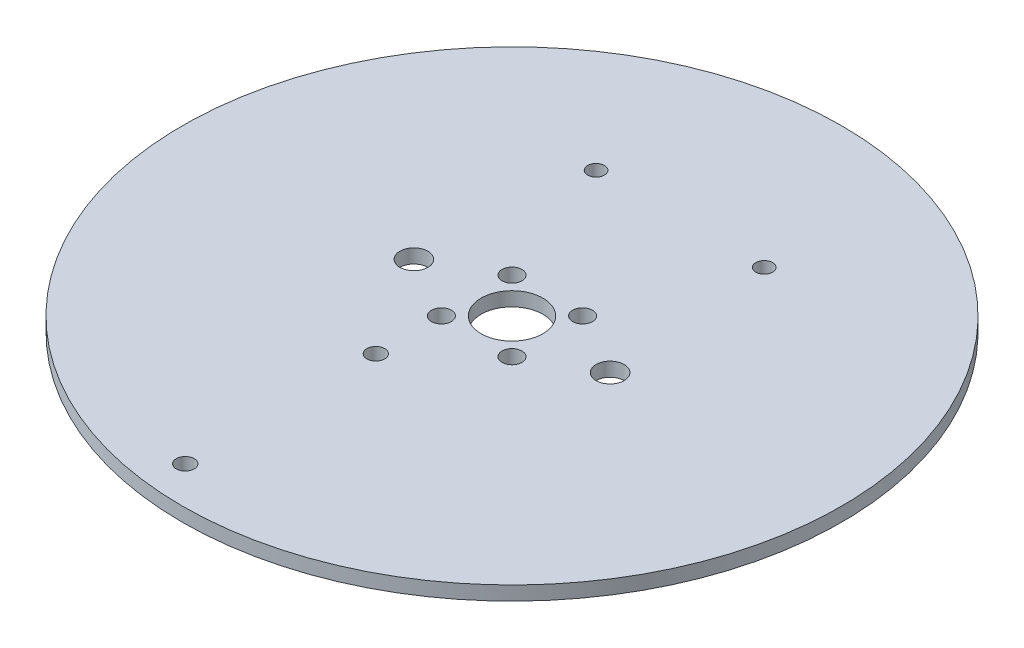
from build123d import *

# Parameters (mm, degrees)
SKETCH1_R               = 74.676
BOSS_EXTRUDE1_DEPTH     = 3.175
CUT_EXTRUDE1_REACH      = 107.656
SKETCH2_R               = 7
CUT_EXTRUDE3_DEPTH      = 106.655527906
CUT_EXTRUDE3_DEPTH_BACK = 106.655527906
SKETCH4_R               = 3.175
M4_CLEARANCE_HOLE1_D    = 4.5
CUT_EXTRUDE4_REACH      = 107.656
SKETCH8_R               = 1.89865
CUT_EXTRUDE5_REACH      = 107.656
SKETCH9_R               = 2.032


with BuildPart() as part:
    # Sketch1 → Boss-Extrude1 (new body)
    with BuildSketch(Plane(origin=(0, 0, 0), x_dir=(1, 0, 0), z_dir=(0, 1, 0))):
        with Locations(Location((0, 0, 0), (0, 0, 270))):
            Circle(SKETCH1_R)
    extrude(amount=BOSS_EXTRUDE1_DEPTH)

    # Sketch2 → Cut-Extrude1 (cut, up to next)
    with BuildSketch(Plane(origin=(0, 3.175, 0), x_dir=(1, 0, 0), z_dir=(0, 1, 0)), mode=Mode.PRIVATE) as cut_extrude1_sk1:
        with Locations(Location((0, 0, 0), (0, 0, 270))):
            Circle(SKETCH2_R)
    cut_extrude1_tool1 = extrude(cut_extrude1_sk1.sketch, amount=-CUT_EXTRUDE1_REACH, mode=Mode.PRIVATE) & part.part
    add(cut_extrude1_tool1.solids().sort_by_distance((0, 3.175, 0))[0], mode=Mode.SUBTRACT)

    # Sketch4 → Cut-Extrude3 (cut, two sides: drawn at the far end of the back side and taken through both)
    with BuildSketch(Plane(origin=(0, 3.175, 0), x_dir=(1, 0, 0), z_dir=(0, 1, 0)).offset(-CUT_EXTRUDE3_DEPTH_BACK)):
        with Locations(Location((-22.225, 0, 0), (0, 0, 270))):
            Circle(SKETCH4_R)
        with Locations(Location((22.225, 0, 0), (0, 0, 270))):
            Circle(SKETCH4_R)
    extrude(amount=CUT_EXTRUDE3_DEPTH + CUT_EXTRUDE3_DEPTH_BACK, mode=Mode.SUBTRACT)

    # M4 Clearance Hole1 (through all)
    with Locations(Plane(origin=(0, 3.175, 0), x_dir=(1, 0, 0), z_dir=(0, 1, 0))):
        with Locations((-8, 8), (8, 8), (8, -8), (-8, -8)):
            Hole(M4_CLEARANCE_HOLE1_D / 2)

    # Sketch8 → Cut-Extrude4 (cut, up to next)
    with BuildSketch(Plane(origin=(0, 3.175, 0), x_dir=(1, 0, 0), z_dir=(0, 1, 0)), mode=Mode.PRIVATE) as cut_extrude4_sk1:
        with Locations(Location((19.05, 38.1, 0), (0, 0, 270))):
            Circle(SKETCH8_R)
    cut_extrude4_tool1 = extrude(cut_extrude4_sk1.sketch, amount=-CUT_EXTRUDE4_REACH, mode=Mode.PRIVATE) & part.part
    # Sketch8 → Cut-Extrude4 (cut, up to next)
    with BuildSketch(Plane(origin=(0, 3.175, 0), x_dir=(1, 0, 0), z_dir=(0, 1, 0)), mode=Mode.PRIVATE) as cut_extrude4_sk2:
        with Locations(Location((-19.05, 38.1, 0), (0, 0, 270))):
            Circle(SKETCH8_R)
    cut_extrude4_tool2 = extrude(cut_extrude4_sk2.sketch, amount=-CUT_EXTRUDE4_REACH, mode=Mode.PRIVATE) & part.part
    add(cut_extrude4_tool1.solids().sort_by_distance((19.05, 3.175, -38.1))[0], mode=Mode.SUBTRACT)
    add(cut_extrude4_tool2.solids().sort_by_distance((-19.05, 3.175, -38.1))[0], mode=Mode.SUBTRACT)

    # Sketch9 → Cut-Extrude5 (cut, up to next)
    with BuildSketch(Plane(origin=(0, 3.175, 0), x_dir=(1, 0, 0), z_dir=(0, 1, 0)), mode=Mode.PRIVATE) as cut_extrude5_sk1:
        with Locations(Location((-8, -22.86, 0), (0, 0, 270))):
            Circle(SKETCH9_R)
    cut_extrude5_tool1 = extrude(cut_extrude5_sk1.sketch, amount=-CUT_EXTRUDE5_REACH, mode=Mode.PRIVATE) & part.part
    # Sketch9 → Cut-Extrude5 (cut, up to next)
    with BuildSketch(Plane(origin=(0, 3.175, 0), x_dir=(1, 0, 0), z_dir=(0, 1, 0)), mode=Mode.PRIVATE) as cut_extrude5_sk2:
        with Locations(Location((-8, -66.04, 0), (0, 0, 270))):
            Circle(SKETCH9_R)
    cut_extrude5_tool2 = extrude(cut_extrude5_sk2.sketch, amount=-CUT_EXTRUDE5_REACH, mode=Mode.PRIVATE) & part.part
    add(cut_extrude5_tool1.solids().sort_by_distance((-8, 3.175, 22.86))[0], mode=Mode.SUBTRACT)
    add(cut_extrude5_tool2.solids().sort_by_distance((-8, 3.175, 66.04))[0], mode=Mode.SUBTRACT)


solid = part.part
